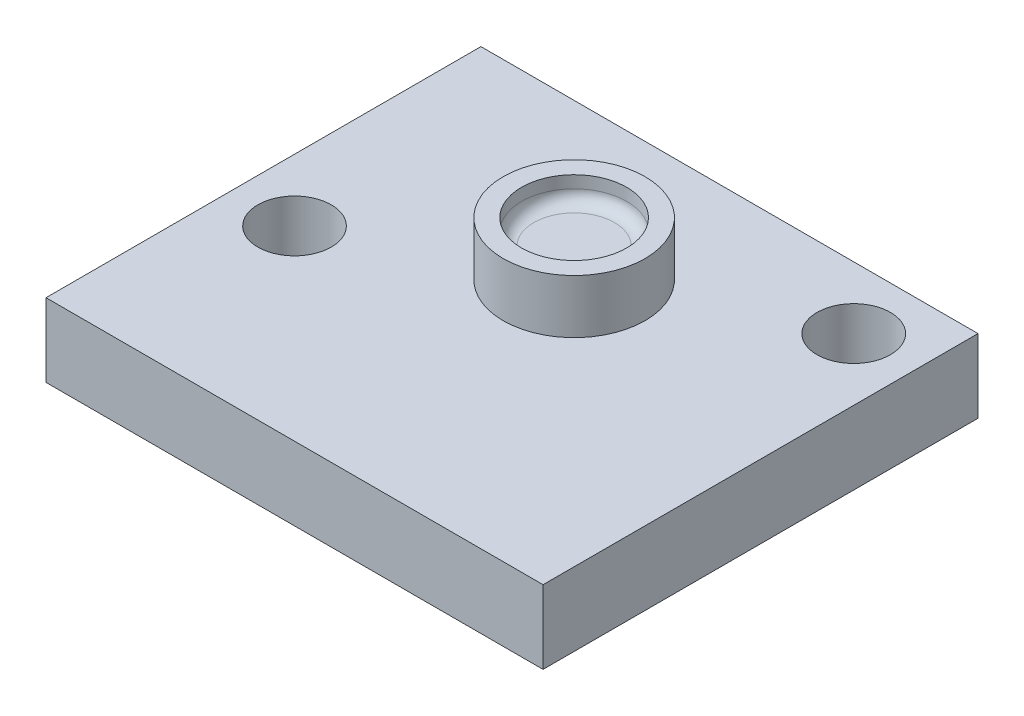
from build123d import *

# Parameters (mm, degrees)
SKETCH2_W           = 20.32
SKETCH2_H           = 17.78
SKETCH2_R           = 1.5
BOSS_EXTRUDE1_DEPTH = 3
SKETCH3_R           = 2.9
BOSS_EXTRUDE2_DEPTH = 2.2
SKETCH4_R           = 2.15
CUT_EXTRUDE1_DEPTH  = 1
FILLET2_R           = 0.5


with BuildPart() as part:
    # Sketch2 → Boss-Extrude1 (new body)
    with BuildSketch(Plane(origin=(0, 0, 0), x_dir=(1, 0, 0), z_dir=(0, 1, 0))):
        Rectangle(SKETCH2_W, SKETCH2_H)
        with Locations(Location((7.62, 6.35, 0), (0, 0, 270))):
            Circle(SKETCH2_R, mode=Mode.SUBTRACT)
        with Locations(Location((-7.62, -1.27, 0), (0, 0, 270))):
            Circle(SKETCH2_R, mode=Mode.SUBTRACT)
    extrude(amount=BOSS_EXTRUDE1_DEPTH)

    # Sketch3 → Boss-Extrude2 (add)
    with BuildSketch(Plane(origin=(0, 3, 0), x_dir=(1, 0, 0), z_dir=(0, 1, 0))):
        with Locations(Location((0, 2.54, 0), (0, 0, 270))):
            Circle(SKETCH3_R)
    extrude(amount=BOSS_EXTRUDE2_DEPTH)

    # Sketch4 → Cut-Extrude1 (cut)
    with BuildSketch(Plane(origin=(0, 5.2, 0), x_dir=(1, 0, 0), z_dir=(0, 1, 0))):
        with Locations(Location((0, 2.54, 0), (0, 0, 270))):
            Circle(SKETCH4_R)
    extrude(amount=-CUT_EXTRUDE1_DEPTH, mode=Mode.SUBTRACT)

    # Fillet2
    fillet2_edges = [part.edges().sort_by_distance(p)[0] for p in [
        (0, 4.2, -4.69),
    ]]
    fillet(fillet2_edges, radius=FILLET2_R)


solid = part.part
